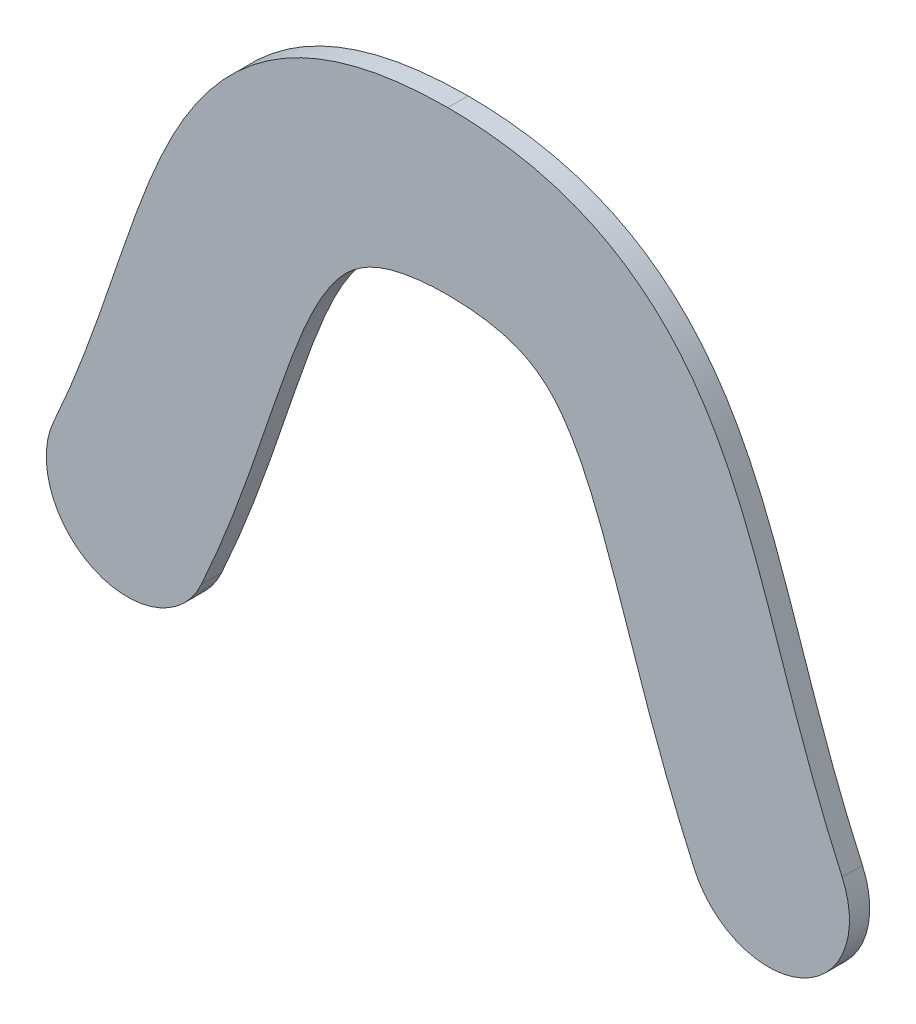
from build123d import *

# Parameters (mm, degrees)
RESSALTO_EXTRUS_O1_DEPTH = 2


with BuildPart() as part:
    # Esboço1 → Ressalto-extrusão1 (new body)
    with BuildSketch(Plane.XY):
        with BuildLine():
            ThreePointArc((38.893705006, -9.482659727), (34.927564841, -20.078400956), (24.331823612, -16.112260791))
            add(Edge.make_bspline(
                [(24.331823612, -16.112260791), (23.983783233, -15.347792057), (23.297762145, -13.795711005), (22.040666859, -10.788977079), (20.628775122, -7.138721433), (19.14644952, -2.991350324), (17.377531729, 2.192111257), (15.428621613, 7.929842512), (13.181256101, 13.324830328), (10.905736924, 16.924357855), (9.076821096, 18.595474149), (7.262882174, 19.596084251), (5.791725077, 20.116726452), (4.32654031, 20.447425561), (3.069290893, 20.641456593), (1.875570082, 20.749035258), (0.838543608, 20.797092045), (0.2758795, 20.807709322), (0, 20.809363979)],
                knots=[0.000709726, 0.000709726, 0.000709726, 0.000709726, 0.031937547, 0.063165368, 0.12562101, 0.188076652, 0.250532294, 0.375443579, 0.500354863, 0.625266147, 0.750177431, 0.812633074, 0.875088716, 0.906316537, 0.937544358, 0.968772179, 0.984386089, 1, 1, 1, 1], degree=3))
            add(Edge.make_bspline(
                [(0, 20.809363979), (-0.2758795, 20.807709322), (-0.838543608, 20.797092045), (-1.875570082, 20.749035258), (-3.069290893, 20.641456593), (-4.32654031, 20.447425561), (-5.791725077, 20.116726452), (-7.262882174, 19.596084251), (-9.076821096, 18.595474149), (-10.905736924, 16.924357855), (-13.181256101, 13.324830328), (-15.428621613, 7.929842512), (-17.377531729, 2.192111257), (-19.14644952, -2.991350324), (-20.628775122, -7.138721433), (-22.040666859, -10.788977079), (-23.297762145, -13.795711005), (-23.983783233, -15.347792057), (-24.331823612, -16.112260791)],
                knots=[0.000709726, 0.000709726, 0.000709726, 0.000709726, 0.016323636, 0.031937547, 0.063165368, 0.094393189, 0.12562101, 0.188076652, 0.250532294, 0.375443579, 0.500354863, 0.625266147, 0.750177431, 0.812633074, 0.875088716, 0.937544358, 0.968772179, 1, 1, 1, 1], degree=3))
            ThreePointArc((-24.331823612, -16.112260791), (-34.927564841, -20.078400956), (-38.893705006, -9.482659727))
            add(Edge.make_bspline(
                [(0, 36.80957368), (-0.824008136, 36.805586773), (-2.490397594, 36.757352704), (-5.667387691, 36.480930952), (-9.444126672, 35.788709944), (-13.637559694, 34.352703321), (-17.425551683, 32.303545323), (-20.705384268, 29.724354472), (-24.34661864, 25.779124547), (-27.644586785, 20.298655172), (-30.485272915, 13.362356543), (-32.541596925, 7.294744093), (-34.255992413, 2.27360154), (-35.630357038, -1.570261297), (-36.894463686, -4.836928388), (-37.998793205, -7.477889954), (-38.591710557, -8.81933062), (-38.893705006, -9.482659727)],
                knots=[-0.000572112, -0.000572112, -0.000572112, -0.000572112, 0.030695767, 0.061963645, 0.124499402, 0.187035159, 0.249570916, 0.312106673, 0.37464243, 0.499713944, 0.624785458, 0.749856972, 0.812392729, 0.874928486, 0.937464243, 0.968732122, 1, 1, 1, 1], degree=3))
            add(Edge.make_bspline(
                [(38.893705006, -9.482659727), (38.591710557, -8.81933062), (37.998793205, -7.477889954), (36.894463686, -4.836928388), (35.630357038, -1.570261297), (34.255992413, 2.27360154), (32.541596925, 7.294744093), (30.485272915, 13.362356543), (27.644586785, 20.298655172), (24.34661864, 25.779124547), (20.705384268, 29.724354472), (17.425551683, 32.303545323), (13.637559694, 34.352703321), (9.444126672, 35.788709944), (5.667387691, 36.480930952), (2.490397594, 36.757352704), (0.824008136, 36.805586773), (0, 36.80957368)],
                knots=[-0.000572112, -0.000572112, -0.000572112, -0.000572112, 0.030695767, 0.061963645, 0.124499402, 0.187035159, 0.249570916, 0.37464243, 0.499713944, 0.624785458, 0.687321215, 0.749856972, 0.812392729, 0.874928486, 0.937464243, 0.968732122, 1, 1, 1, 1], degree=3))
        make_face()
    extrude(amount=RESSALTO_EXTRUS_O1_DEPTH)


solid = part.part
